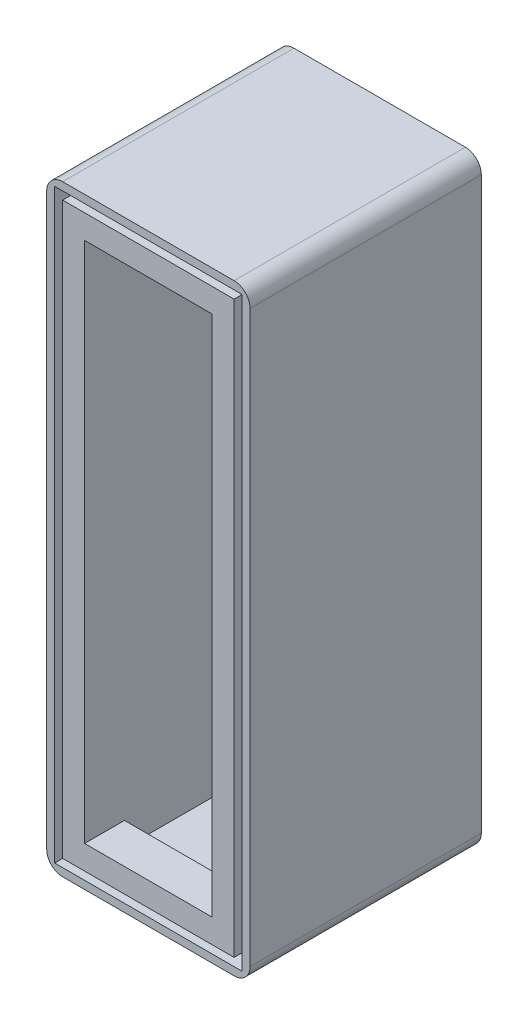
from build123d import *

# Parameters (mm, degrees)
SKETCH1_W                  = 25.5
SKETCH1_H                  = 75.5
MAIN_BODY_DEPTH            = 29
SKETCH2_W                  = 16
SKETCH2_H                  = 71.5
BATTERY_CUT_DEPTH          = 17
SKETCH3_W                  = 22
SKETCH3_H                  = 71.5
PCB_CUT_DEPTH              = 12
SKETCH4_W                  = 23.25
SKETCH4_H                  = 63.5
SOLAR_CUT_DEPTH            = 2
SKETCH5_W                  = 22
SKETCH5_H                  = 8.875
SOLAR_GAP_FILL_DEPTH       = 2
USB_CUT_DEPTH              = 2
USB_CLEARANCE_EMBOSS_DEPTH = 1
FILLET1_R                  = 2
SKETCH9_W                  = 23.5
SKETCH9_H                  = 73.5
SKETCH9_W_2                = 21.5
SKETCH9_H_2                = 71.5
CUT_EXTRUDE7_DEPTH         = 2
SKETCH10_W                 = 16
SKETCH10_H                 = 3
BOSS_EXTRUDE3_DEPTH        = 5
SKETCH11_W                 = 21.795239569
SKETCH11_H                 = 9.375
BOSS_EXTRUDE4_DEPTH        = 1


with BuildPart() as part:
    # Sketch1 → main body (new body)
    with BuildSketch(Plane.XY):
        with Locations((6.796111111, -10.402222222)):
            Rectangle(SKETCH1_W, SKETCH1_H)
    extrude(amount=MAIN_BODY_DEPTH)

    # Sketch2 → battery cut (cut)
    with BuildSketch(Plane.XY.offset(29)):
        with Locations((6.796111111, -10.402222222)):
            Rectangle(SKETCH2_W, SKETCH2_H)
    extrude(amount=-BATTERY_CUT_DEPTH, mode=Mode.SUBTRACT)

    # Sketch3 → pcb cut (cut)
    with BuildSketch(Plane(origin=(0, 0, 0), x_dir=(-1, 0, 0), z_dir=(0, 0, -1))):
        with Locations((-6.796111111, -10.402222222)):
            Rectangle(SKETCH3_W, SKETCH3_H)
    extrude(amount=-PCB_CUT_DEPTH, mode=Mode.SUBTRACT)

    # Sketch4 → solar cut (cut)
    with BuildSketch(Plane(origin=(0, 0, 0), x_dir=(-1, 0, 0), z_dir=(0, 0, -1))):
        with Locations((-6.796111111, -15.277222222)):
            Rectangle(SKETCH4_W, SKETCH4_H)
    extrude(amount=-SOLAR_CUT_DEPTH, mode=Mode.SUBTRACT)

    # Sketch6 → USB cut (cut)
    with BuildSketch(Plane.XZ.offset(48.152222222)):
        with BuildLine():
            Line((9.796111111, 5.5), (3.796111111, 5.5))
            ThreePointArc((3.796111111, 5.5), (2.046111111, 7.25), (3.796111111, 9))
            Line((3.796111111, 9), (9.796111111, 9))
            ThreePointArc((9.796111111, 9), (11.546111111, 7.25), (9.796111111, 5.5))
        make_face()
    extrude(amount=-USB_CUT_DEPTH, mode=Mode.SUBTRACT)

    # Sketch7 → USB clearance emboss (cut)
    with BuildSketch(Plane.XZ.offset(48.152222222)):
        with BuildLine():
            Line((9.296111111, 3.75), (4.296111111, 3.75))
            ThreePointArc((4.296111111, 3.75), (0.796111111, 7.25), (4.296111111, 10.75))
            Line((4.296111111, 10.75), (9.296111111, 10.75))
            ThreePointArc((9.296111111, 10.75), (12.796111111, 7.25), (9.296111111, 3.75))
        make_face()
    extrude(amount=-USB_CLEARANCE_EMBOSS_DEPTH, mode=Mode.SUBTRACT)

    # Fillet1
    fillet1_edges = [part.edges().sort_by_distance(p)[0] for p in [
        (-5.953888889, 27.347777778, 14.5),
        (19.546111111, 27.347777778, 14.5),
        (19.546111111, -48.152222222, 14.5),
        (-5.953888889, -48.152222222, 14.5),
    ]]
    fillet(fillet1_edges, radius=FILLET1_R)

    # Sketch9 → Cut-Extrude7 (cut)
    with BuildSketch(Plane.XY.offset(29)):
        with Locations((6.796111111, -10.402222222)):
            Rectangle(SKETCH9_W, SKETCH9_H)
        with Locations((6.796111111, -10.402222222)):
            Rectangle(SKETCH9_W_2, SKETCH9_H_2, mode=Mode.SUBTRACT)
    extrude(amount=-CUT_EXTRUDE7_DEPTH, mode=Mode.SUBTRACT)

    # Sketch10 → Boss-Extrude3 (add)
    with BuildSketch(Plane.XY.offset(29)):
        with Locations((6.796111111, 23.847777778)):
            Rectangle(SKETCH10_W, SKETCH10_H)
        with Locations((6.796111111, -44.652222222)):
            Rectangle(SKETCH10_W, SKETCH10_H)
    extrude(amount=-BOSS_EXTRUDE3_DEPTH)



with BuildPart() as body_2:
    # Sketch5 → solar gap fill (new body)
    with BuildSketch(Plane(origin=(0, 0, 0), x_dir=(-1, 0, 0), z_dir=(0, 0, -1))):
        with Locations((-6.796111111, 20.910277778)):
            Rectangle(SKETCH5_W, SKETCH5_H)
    extrude(amount=-SOLAR_GAP_FILL_DEPTH)


with BuildPart() as part_1:
    add(part.part)

    add(body_2.part)  # Boss-Extrude4 merges body 2
    # Sketch11 → Boss-Extrude4 (add)
    with BuildSketch(Plane.XY.offset(2)):
        with Locations((6.693730896, 20.660277778)):
            Rectangle(SKETCH11_W, SKETCH11_H)
    extrude(amount=BOSS_EXTRUDE4_DEPTH)


solid = part_1.part
